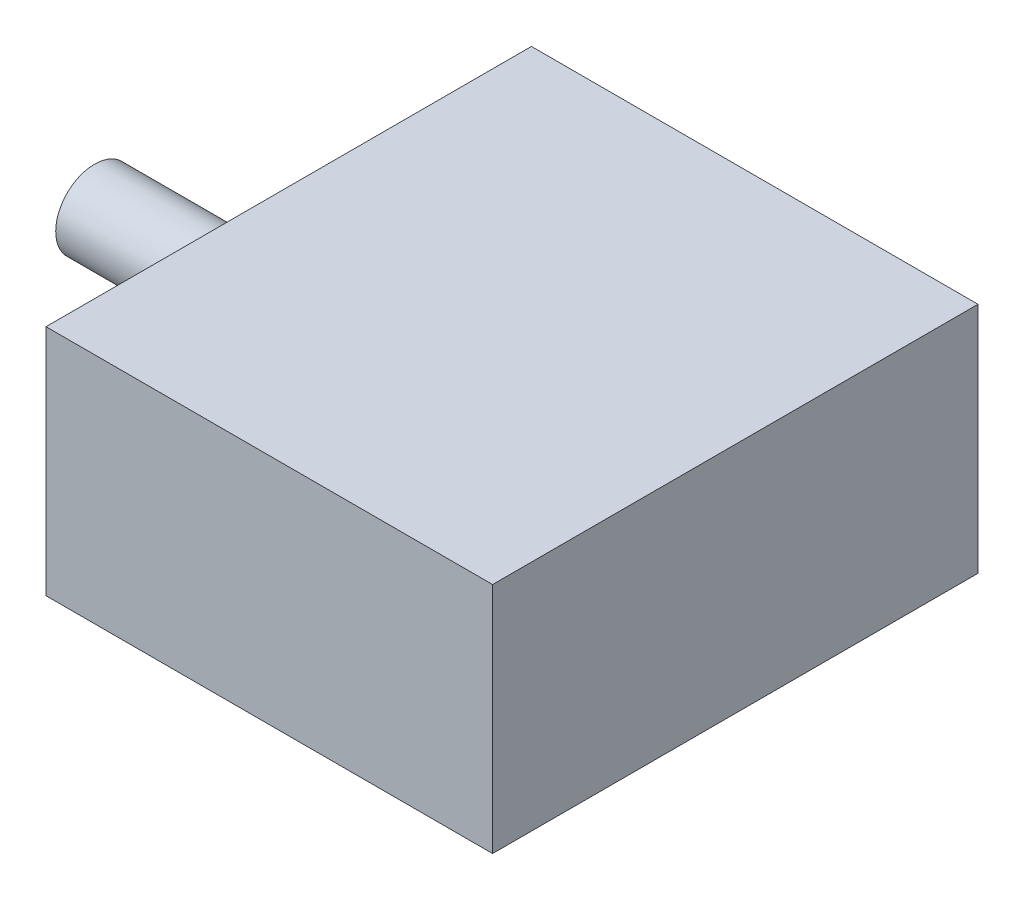
from build123d import *

# Parameters (mm, degrees)
ESQUISSE1_W        = 23
ESQUISSE1_H        = 12
BOSS_EXTRU_1_DEPTH = 25
ESQUISSE4_R        = 2
BOSS_EXTRU_2_DEPTH = 10


with BuildPart() as part:
    # Esquisse1 → Boss.-Extru.1 (new body)
    with BuildSketch(Plane.XY):
        with Locations((11.5, 6)):
            Rectangle(ESQUISSE1_W, ESQUISSE1_H)
    extrude(amount=BOSS_EXTRU_1_DEPTH)

    # Esquisse4 → Boss.-Extru.2 (add)
    with BuildSketch(Plane.ZY):
        with Locations(Location((12.5, 6, 0), (0, 0, 180))):
            Circle(ESQUISSE4_R)
    extrude(amount=BOSS_EXTRU_2_DEPTH)


solid = part.part
